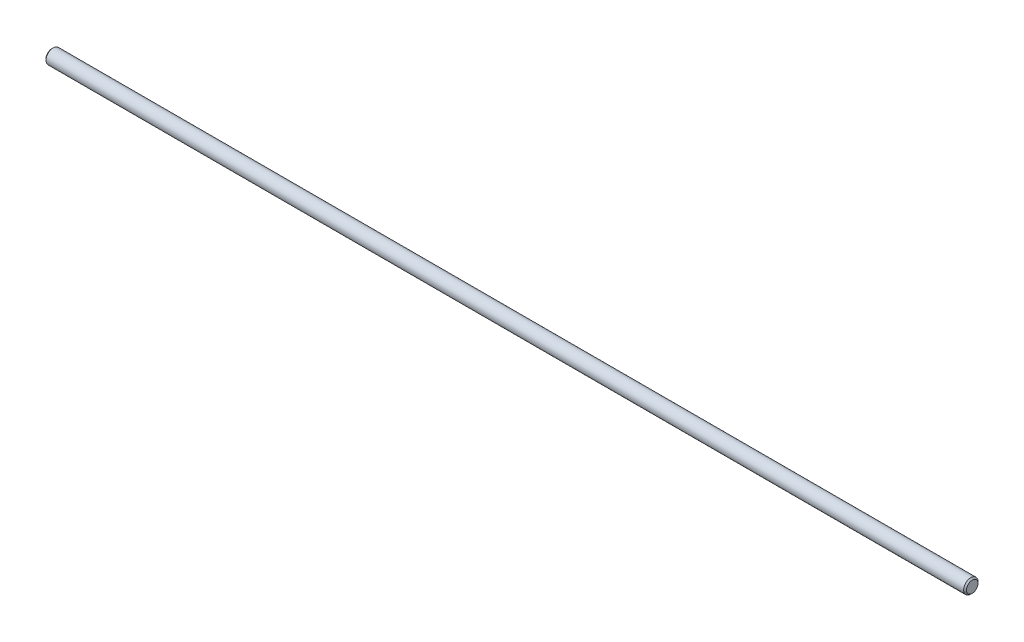
from build123d import *

# Parameters (mm, degrees)
EXTRUDE1_DEPTH      = 203.2
EXTRUDE1_DEPTH_BACK = 203.2
SKETCH2_R           = 3.175
CHAMFER1_SIZE       = 0.635


with BuildPart() as part:
    # Sketch2 → Extrude1 (new, two sides: drawn at the far end of the back side and taken through both)
    with BuildSketch(Plane(origin=(0, 0, 0), x_dir=(0, 0, -1), z_dir=(1, 0, 0)).offset(-EXTRUDE1_DEPTH_BACK)):
        Circle(SKETCH2_R)
    extrude(amount=EXTRUDE1_DEPTH + EXTRUDE1_DEPTH_BACK)

    # Chamfer1
    chamfer1_edges = [part.edges().sort_by_distance(p)[0] for p in [
        (-203.2, 0, 3.175),
        (203.2, 0, 3.175),
    ]]
    chamfer(chamfer1_edges, length=CHAMFER1_SIZE)


solid = part.part
